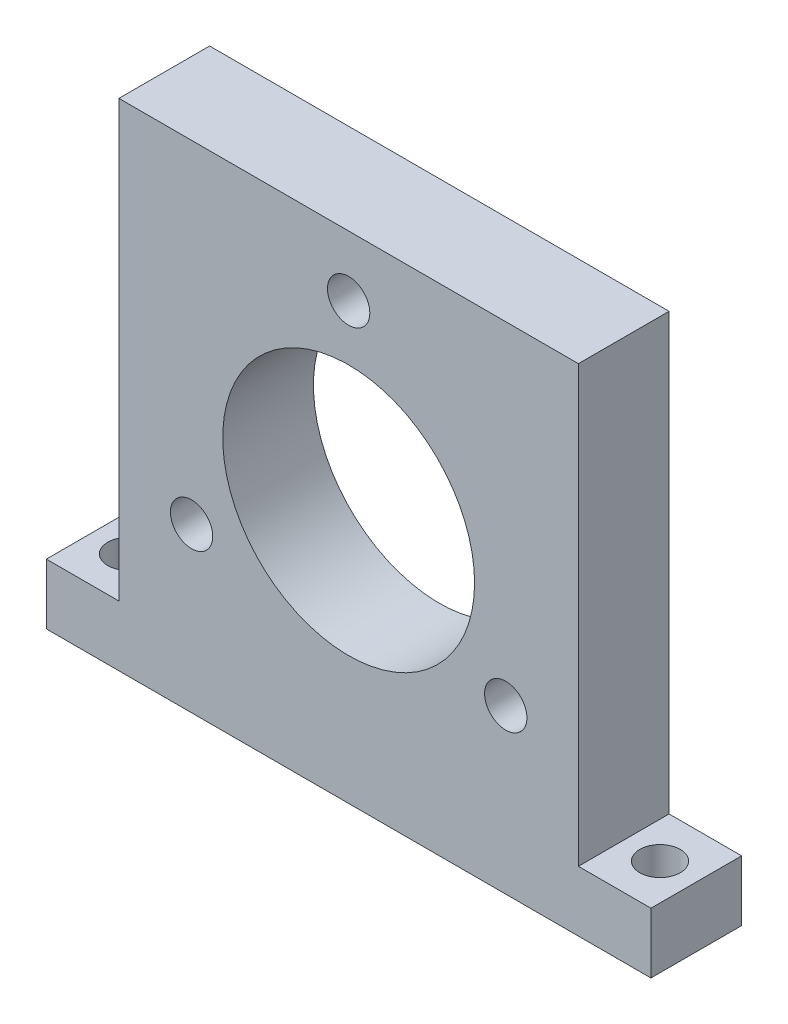
from build123d import *

# Parameters (mm, degrees)
SKETCH2_R           = 10.414
BOSS_EXTRUDE1_DEPTH = 7.5
SKETCH5_R           = 1.75
CUT_EXTRUDE3_DEPTH  = 49.602983448
CIRPATTERN1_COUNT   = 3
SKETCH6_R           = 1.675
CUT_EXTRUDE4_DEPTH  = 45.466279359


with BuildPart() as part:
    # Sketch2 → Boss-Extrude1 (new body)
    with BuildSketch(Plane.XY):
        Polygon((-25, 0), (25, 0), (25, 5), (19, 5), (19, 41), (-19, 41), (-19, 5), (-25, 5), align=None)
        with Locations((0, 21)):
            Circle(SKETCH2_R, mode=Mode.SUBTRACT)
    extrude(amount=-BOSS_EXTRUDE1_DEPTH)

    # Sketch5 → Cut-Extrude3 (cut, through all)
    with BuildSketch(Plane.XY):
        with Locations((0, 36)):
            Circle(SKETCH5_R)
    cut_extrude3 = extrude(amount=-CUT_EXTRUDE3_DEPTH, mode=Mode.SUBTRACT)

    # CirPattern1: Cut-Extrude3 ×3 about axis
    cirpattern1_axis = Axis((0, 21, 0), (0, 0, 1))
    for i in range(1, CIRPATTERN1_COUNT):
        add(cut_extrude3.rotate(cirpattern1_axis, i * 360 / CIRPATTERN1_COUNT), mode=Mode.SUBTRACT)

    # Sketch6 → Cut-Extrude4 (cut, through all)
    with BuildSketch(Plane(origin=(0, 5, 0), x_dir=(1, 0, 0), z_dir=(0, 1, 0))):
        with Locations(Location((22, 3.75, 0), (0, 0, 270))):
            Circle(SKETCH6_R)
        with Locations(Location((-22, 3.75, 0), (0, 0, 270))):
            Circle(SKETCH6_R)
    extrude(amount=-CUT_EXTRUDE4_DEPTH, mode=Mode.SUBTRACT)


solid = part.part
